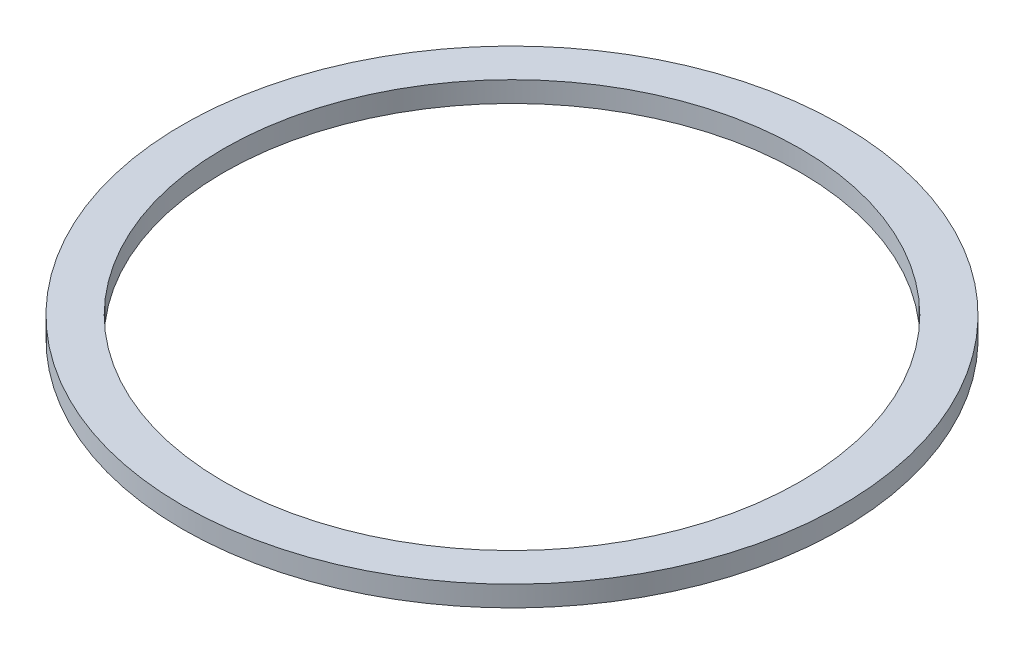
from build123d import *

# Parameters (mm, degrees)
SKETCH1_R           = 8
SKETCH1_R_2         = 7
BOSS_EXTRUDE1_DEPTH = 0.5


with BuildPart() as part:
    # Sketch1 → Boss-Extrude1 (new body)
    with BuildSketch(Plane(origin=(0, 0, 0), x_dir=(1, 0, 0), z_dir=(0, 1, 0))):
        with Locations(Location((0, 0, 0), (0, 0, 270))):
            Circle(SKETCH1_R)
        with Locations(Location((0, 0, 0), (0, 0, 270))):
            Circle(SKETCH1_R_2, mode=Mode.SUBTRACT)
    extrude(amount=BOSS_EXTRUDE1_DEPTH)


solid = part.part
